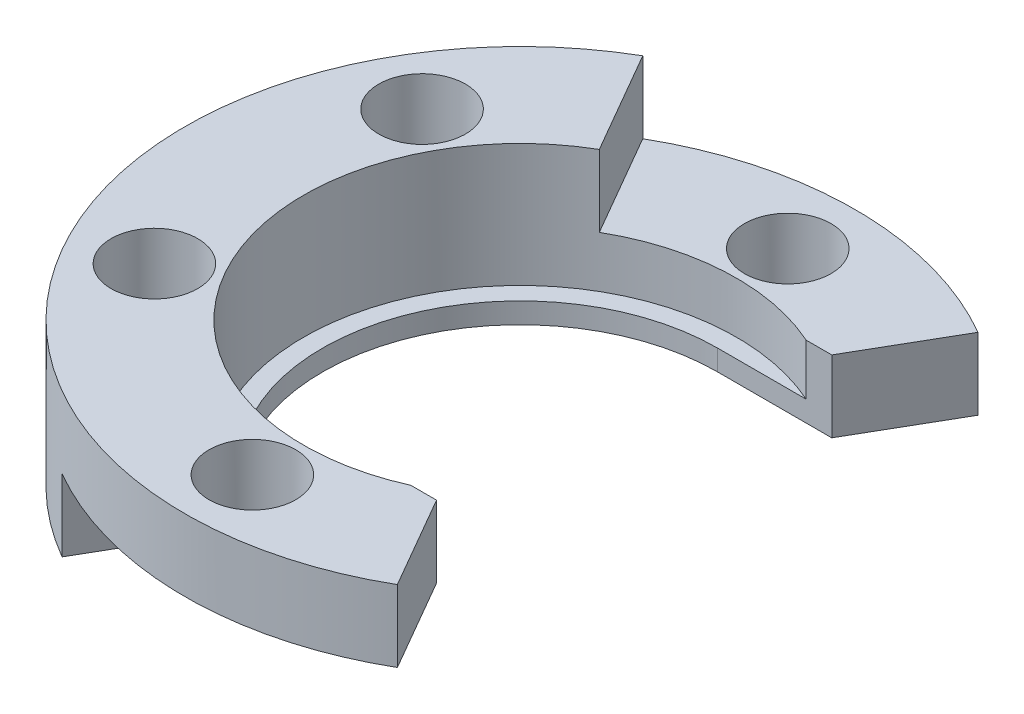
from build123d import *

# Parameters (mm, degrees)
SKETCH1_R         = 16.891
EXTRUDE1_DEPTH    = 7.239
SKETCH2_R         = 10.9093
EXTRUDE2_DEPTH    = 25.960266084
SKETCH3_R         = 10.9093
SKETCH3_R_2       = 9.9568
EXTRUDE3_DEPTH    = 1.0414
SKETCH4_R         = 2.1844
EXTRUDE4_DEPTH    = 25.960266084
CIRPATTERN1_COUNT = 6
SKETCH5_W         = 23.383447214
SKETCH5_H         = 19.9136
EXTRUDE6_DEPTH    = 25.960266084
EXTRUDE7_DEPTH    = 25.960266084
EXTRUDE8_DEPTH    = 3.6195
EXTRUDE9_DEPTH    = 3.6195


with BuildPart() as part:
    # Sketch1 → Extrude1 (new body)
    with BuildSketch(Plane(origin=(0, 0, 0), x_dir=(1, 0, 0), z_dir=(0, 1, 0))):
        with Locations(Location((0, 0, 0), (0, 0, 270))):
            Circle(SKETCH1_R)
    extrude(amount=EXTRUDE1_DEPTH)

    # Sketch2 → Extrude2 (cut, through all)
    with BuildSketch(Plane.XZ):
        with Locations(Location((0, 0, 0), (0, 0, 270))):
            Circle(SKETCH2_R)
    extrude(amount=-EXTRUDE2_DEPTH, mode=Mode.SUBTRACT)

    # Sketch3 → Extrude3 (add)
    with BuildSketch(Plane.XZ):
        with Locations(Location((0, 0, 0), (0, 0, 270))):
            Circle(SKETCH3_R)
        with Locations(Location((0, 0, 0), (0, 0, 270))):
            Circle(SKETCH3_R_2, mode=Mode.SUBTRACT)
    extrude(amount=-EXTRUDE3_DEPTH)

    # Sketch4 → Extrude4 (cut, through all)
    with BuildSketch(Plane(origin=(0, 7.239, 0), x_dir=(1, 0, 0), z_dir=(0, 1, 0))):
        with Locations(Location((0, 13.4874, 0), (0, 0, 270))):
            Circle(SKETCH4_R)
    extrude4 = extrude(amount=-EXTRUDE4_DEPTH, mode=Mode.SUBTRACT)

    # CirPattern1: Extrude4 ×6 about axis
    cirpattern1_axis = Axis((0, 0, 0), (0, 1, 0))
    for i in range(1, CIRPATTERN1_COUNT):
        add(extrude4.rotate(cirpattern1_axis, i * 360 / CIRPATTERN1_COUNT), mode=Mode.SUBTRACT)

    # Sketch5 → Extrude6 (cut, through all)
    with BuildSketch(Plane(origin=(0, 7.239, 0), x_dir=(1, 0, 0), z_dir=(0, 1, 0))):
        with Locations((11.691723607, 0)):
            Rectangle(SKETCH5_W, SKETCH5_H)
    extrude(amount=-EXTRUDE6_DEPTH, mode=Mode.SUBTRACT)

    # Sketch8 → Extrude7 (cut, through all)
    with BuildSketch(Plane(origin=(0, 7.239, 0), x_dir=(1, 0, 0), z_dir=(0, 1, 0))):
        Polygon((0, 0), (17.025211733, 0), (17.025211733, 29.488531731), align=None)
    extrude7 = extrude(amount=-EXTRUDE7_DEPTH, mode=Mode.SUBTRACT)

    # Mirror1: Extrude7 across plane
    add(extrude7.mirror(Plane.XY), mode=Mode.SUBTRACT)

    # Sketch9 → Extrude8 (cut)
    with BuildSketch(Plane(origin=(0, 7.239, 0), x_dir=(1, 0, 0), z_dir=(0, 1, 0))):
        Polygon((0, 0), (-11.081515353, 19.193747616), (11.081515353, 19.193747616), align=None)
    extrude(amount=-EXTRUDE8_DEPTH, mode=Mode.SUBTRACT)

    # Sketch10 → Extrude9 (cut)
    with BuildSketch(Plane.XZ):
        Polygon((0, 0), (-13.504747016, 23.390907976), (14.410908918, 24.960426429), align=None)
    extrude(amount=-EXTRUDE9_DEPTH, mode=Mode.SUBTRACT)


solid = part.part
